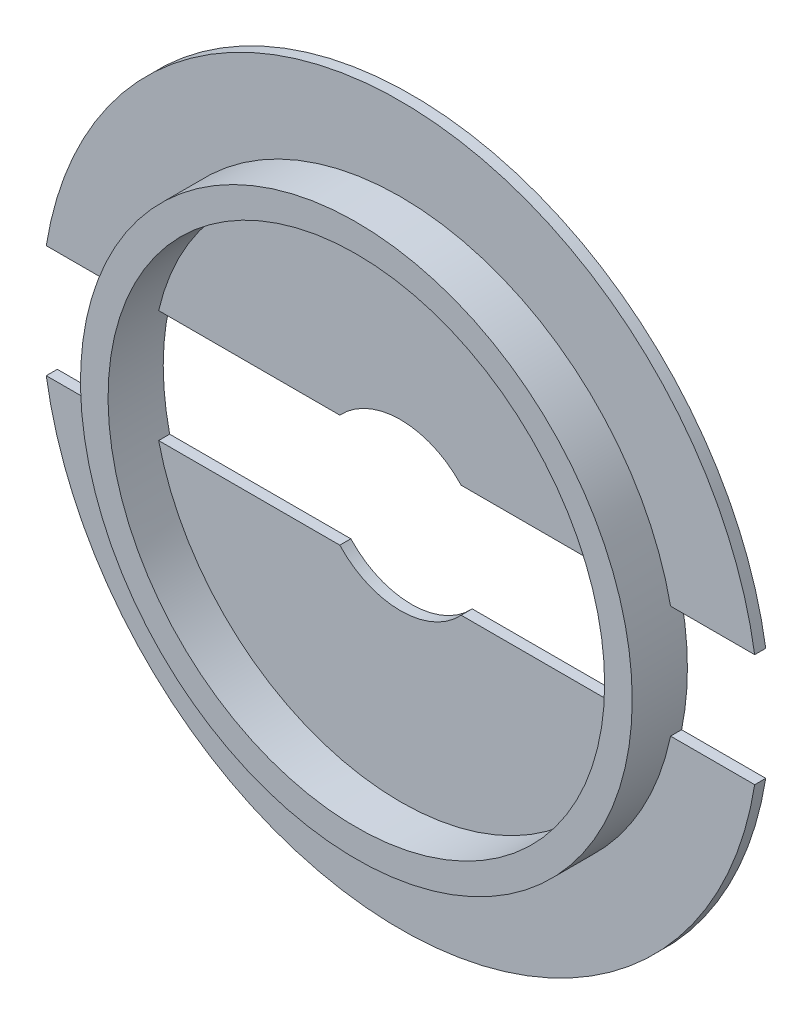
from build123d import *

# Parameters (mm, degrees)
RESSALTO_EXTRUS_O1_DEPTH   = 2
RESSALTO_EXTRUS_O1_2_DEPTH = 2
ESBO_O2_R                  = 50
ESBO_O2_R_2                = 45
RESSALTO_EXTRUS_O2_DEPTH   = 10


with BuildPart() as part:
    # Esboço1 → Ressalto-extrusão1 (new body)
    with BuildSketch(Plane.XY):
        with BuildLine():
            Line((-64.194703831, 10.2), (-10.998181668, 10.2))
            ThreePointArc((-10.998181668, 10.2), (0, 15), (10.998181668, 10.2))
            Line((10.998181668, 10.2), (64.194703831, 10.2))
            ThreePointArc((64.194703831, 10.2), (0, 65), (-64.194703831, 10.2))
        make_face()
    extrude(amount=RESSALTO_EXTRUS_O1_DEPTH)



with BuildPart() as body_2:
    # Esboço1 → Ressalto-extrus_o1 2 (new body)
    with BuildSketch(Plane.XY):
        with BuildLine():
            Line((-10.998181668, -10.2), (-64.194703831, -10.2))
            ThreePointArc((-64.194703831, -10.2), (0, -65), (64.194703831, -10.2))
            Line((64.194703831, -10.2), (10.998181668, -10.2))
            ThreePointArc((10.998181668, -10.2), (0, -15), (-10.998181668, -10.2))
        make_face()
    extrude(amount=RESSALTO_EXTRUS_O1_2_DEPTH)


with BuildPart() as part_1:
    add(part.part)

    add(body_2.part)  # Ressalto-extrusão2 merges body 2
    # Esboço2 → Ressalto-extrusão2 (add)
    with BuildSketch(Plane.XY):
        with Locations(Location((0, 0, 0), (0, 0, 168.229033732))):
            Circle(ESBO_O2_R)
        with Locations(Location((0, 0, 0), (0, 0, 166.899096466))):
            Circle(ESBO_O2_R_2, mode=Mode.SUBTRACT)
    extrude(amount=RESSALTO_EXTRUS_O2_DEPTH)


solid = part_1.part
